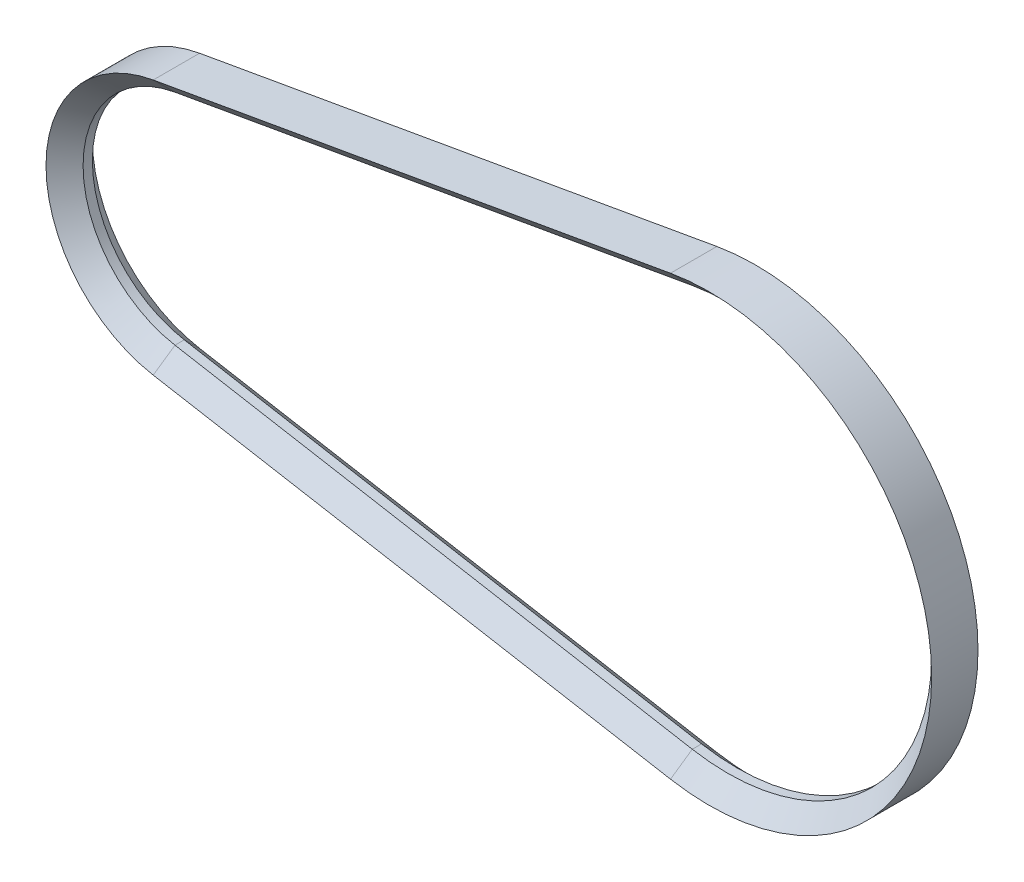
from build123d import *


with BuildPart() as part:
    # Balayage1: sweep along a path in Esquisse1
    with BuildLine(Plane.XY) as balayage1_path:
        Line((26.858286409, 10.832605926), (-1.042752868, 5.908694141))
        ThreePointArc((-1.042752868, 5.908694141), (-6, 0), (-1.042752868, -5.908694141))
        Line((-1.042752868, -5.908694141), (26.858286409, -10.832605926))
        ThreePointArc((26.858286409, -10.832605926), (39.77, 0), (26.858286409, 10.832605926))
    # Esquisse2 → Balayage1 (sweep)
    with BuildSketch(Plane(origin=(0, 0, 0), x_dir=(1, 0, 0), z_dir=(0, 1, 0))):
        Polygon((-7, -1.25), (-7, 1.25), (-6, 0.25), (-6, -0.25), align=None)
    sweep(path=balayage1_path.line)


solid = part.part
